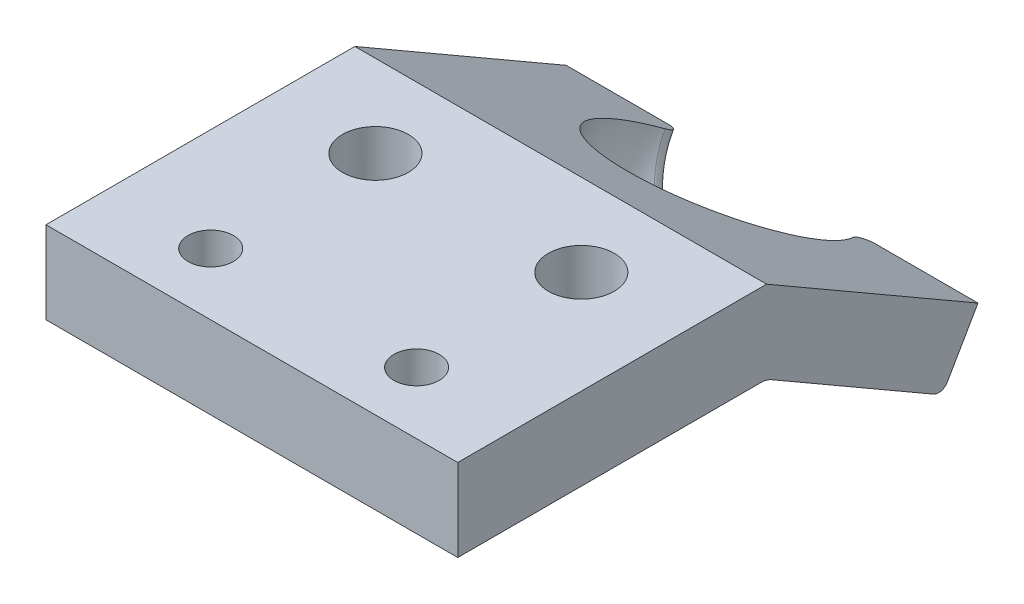
from build123d import *

# Parameters (mm, degrees)
SKETCH_1_R               = 5
EXTRUDE_1_DEPTH          = 8
EXTRUDE_2_DEPTH          = 10
EXTRUDE_2_DEPTH_BACK     = 10
FILLET_1_R               = 0.5
SKETCH_6_R               = 1.6
SKETCH_6_R_2             = 1.1
CUT_EXTRUDE_1_DEPTH      = 67.938579217
CUT_EXTRUDE_2_DEPTH      = 67.199195672
CUT_EXTRUDE_2_DEPTH_BACK = 67.199195672
CUT_EXTRUDE_3_DEPTH      = 55.878761072
FILLET_2_R               = 1


with BuildPart() as part:
    # 草图1 → 凸台-拉伸1 (new body)
    with BuildSketch(Plane(origin=(0, 0, 0), x_dir=(1, 0, 0), z_dir=(0, 1, 0))):
        Polygon((11.547005384, 40), (-11.547005384, 40), (-40.414518843, -10), (-28.867513459, -30), (28.867513459, -30), (40.414518843, -10), align=None)
        Circle(SKETCH_1_R, mode=Mode.SUBTRACT)
    extrude(amount=EXTRUDE_1_DEPTH)

    # 草图2 → 凸台-拉伸2 (add, two sides: drawn at the far end of the back side and taken through both)
    with BuildSketch(Plane(origin=(0, 0, 0), x_dir=(0, 0, -1), z_dir=(1, 0, 0)).offset(-EXTRUDE_2_DEPTH_BACK)):
        Polygon((40, 8), (40, 0), (48.535898385, -4.92820323), (52, 1.07179677), align=None)
    extrude(amount=EXTRUDE_2_DEPTH + EXTRUDE_2_DEPTH_BACK)

    # 草图4 → 切除-旋转1 (revolve, cut)
    with BuildSketch(Plane(origin=(0, 0, 0), x_dir=(0, 0, -1), z_dir=(1, 0, 0))):
        with BuildLine():
            Line((50.219872981, 3.988526329), (45.119872981, -4.84493279))
            ThreePointArc((45.119872981, -4.84493279), (52.08660254, -2.97820323), (50.219872981, 3.988526329))
        make_face()
    revolve(axis=Axis((0, 2.57179677, -49.401923789), (0, -0.8660254037844388, 0.4999999999999997)), mode=Mode.SUBTRACT)

    # 圆角1
    fillet_1_edges = [part.edges().sort_by_distance(p)[0] for p in [
        (6.119151464, -4.92820323, -48.535898385),
        (-6.119151464, -4.92820323, -48.535898385),
        (-6.119151464, 1.07179677, -52),
        (-4.124318125, -1.92820323, -50.267949192),
        (0, -1.556706503, -42.696294756),
        (4.124318125, -1.92820323, -50.267949192),
        (0, 4.443293497, -46.160396371),
        (6.119151464, 1.07179677, -52),
    ]]
    fillet(fillet_1_edges, radius=FILLET_1_R)

    # 草图6 → 切除-拉伸1 (cut, through all)
    with BuildSketch(Plane(origin=(0, 8, 0), x_dir=(1, 0, 0), z_dir=(0, 1, 0))):
        with Locations((-5, 36)):
            Circle(SKETCH_6_R)
        with Locations((5, 36)):
            Circle(SKETCH_6_R)
        with Locations((-5, 28)):
            Circle(SKETCH_6_R_2)
        with Locations((5, 28)):
            Circle(SKETCH_6_R_2)
    extrude(amount=-CUT_EXTRUDE_1_DEPTH, mode=Mode.SUBTRACT)

    # 草图7 → 切除-拉伸2 (cut, two sides: drawn at the far end of the back side and taken through both)
    with BuildSketch(Plane(origin=(0, 0, 0), x_dir=(0, 0, -1), z_dir=(1, 0, 0)).offset(-CUT_EXTRUDE_2_DEPTH_BACK)):
        Polygon((50.267949192, -1.92820323), (40, 4), (25, 4), (25, 0), (-30, 0), (-30, 8), (40, 8), (51.566987298, 1.32179677), (52, 1.07179677), (51.75, 0.638784068), align=None)
    extrude(amount=CUT_EXTRUDE_2_DEPTH + CUT_EXTRUDE_2_DEPTH_BACK, mode=Mode.SUBTRACT)

    # 草图8 → 切除-拉伸3 (cut, through all)
    with BuildSketch(Plane(origin=(0, 4, 0), x_dir=(1, 0, 0), z_dir=(0, 1, 0))):
        Polygon((-10, 40), (-11.547005384, 40), (-20.207259422, 25), (-10, 25), align=None)
        Polygon((10, 40), (11.547005384, 40), (20.207259422, 25), (10, 25), align=None)
    extrude(amount=-CUT_EXTRUDE_3_DEPTH, mode=Mode.SUBTRACT)

    # 圆角2
    fillet_2_edges = [part.edges().sort_by_distance(p)[0] for p in [
        (0, 0, -40),
    ]]
    fillet(fillet_2_edges, radius=FILLET_2_R)


solid = part.part
